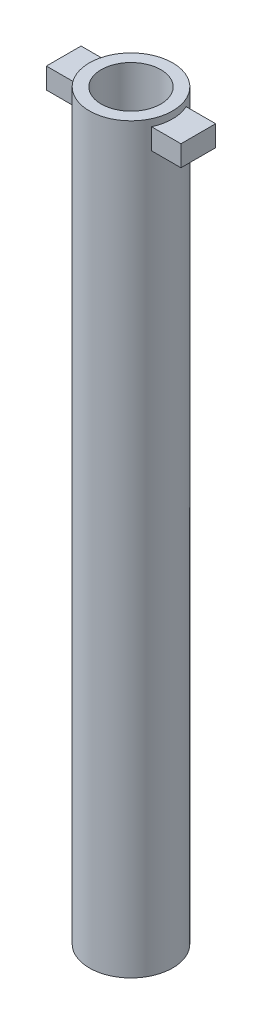
from build123d import *

# Parameters (mm, degrees)
SKETCH_1_W                = 6
SKETCH_1_H                = 107
SKETCH_3_W                = 19.4
SKETCH_3_H                = 3
INTERNAL_OUTPUT_KEY_DEPTH = 5
SKETCH_4_R                = 4.3
SCREW_CLEARANCE_DEPTH     = 52


with BuildPart() as part:
    # 草图1 → Output_tube (revolve)
    with BuildSketch(Plane.XY, mode=Mode.PRIVATE) as output_tube_sk:
        with Locations((3, 53.5)):
            Rectangle(SKETCH_1_W, SKETCH_1_H)
    revolve(output_tube_sk.sketch.rotate(Axis((0, 0, 0), (0, 1, 0)), 90), axis=Axis((0, 0, 0), (0, 1, 0)))

    # 草图3 → Internal_output_key (add)
    with BuildSketch(Plane.XY.offset(-2.5)):
        with Locations((0, 104.5)):
            Rectangle(SKETCH_3_W, SKETCH_3_H)
    extrude(amount=INTERNAL_OUTPUT_KEY_DEPTH)

    # 草图4 → Screw_clearance (cut)
    with BuildSketch(Plane(origin=(0, 107, 0), x_dir=(1, 0, 0), z_dir=(0, 1, 0))):
        with Locations(Location((0, 0, 0), (0, 0, 270))):
            Circle(SKETCH_4_R)
    extrude(amount=-SCREW_CLEARANCE_DEPTH, mode=Mode.SUBTRACT)


solid = part.part
